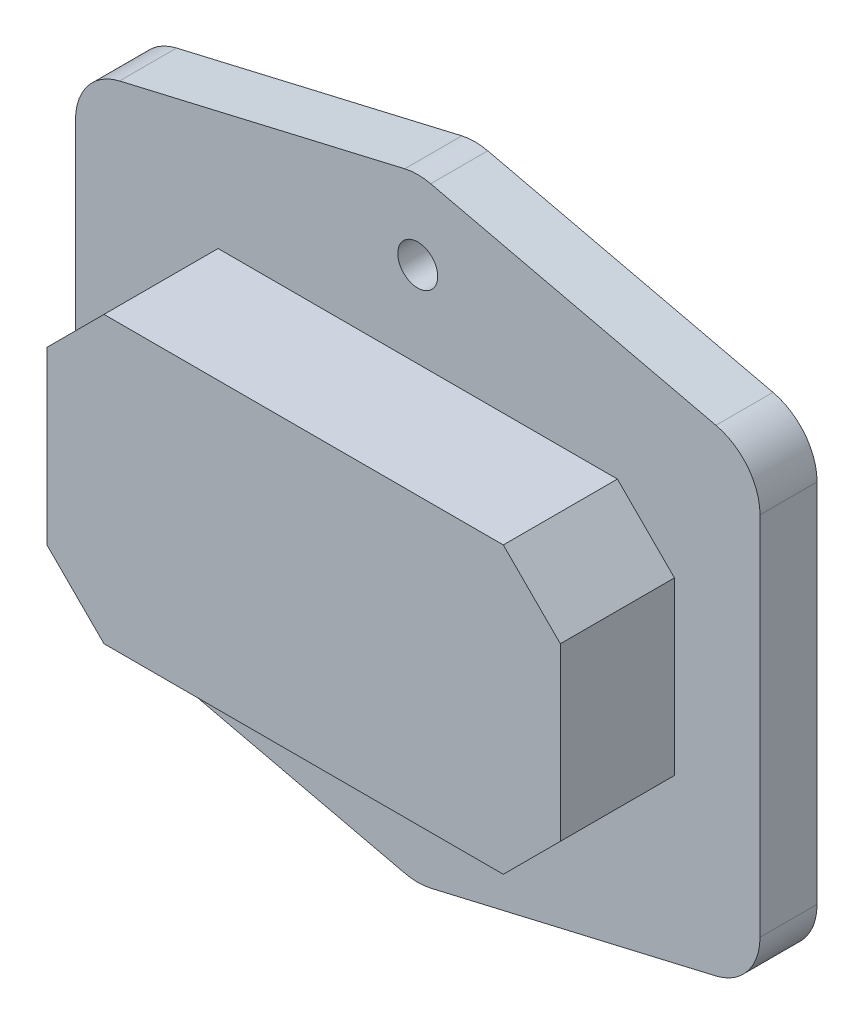
from build123d import *

# Parameters (mm, degrees)
SKETCH1_W           = 45
SKETCH1_H           = 25
BOSS_EXTRUDE1_DEPTH = 10
SKETCH2_R           = 1.75
BOSS_EXTRUDE2_DEPTH = 5
FILLET1_R           = 5
CUT_EXTRUDE1_DEPTH  = 10
SKETCH4_W           = 1
SKETCH4_H           = 20
BOSS_EXTRUDE3_DEPTH = 15
BOSS_EXTRUDE4_DEPTH = 11
CHAMFER1_SIZE       = 5


with BuildPart() as part:
    # Sketch1 → Boss-Extrude1 (new body)
    with BuildSketch(Plane.XY):
        Rectangle(SKETCH1_W, SKETCH1_H)
    extrude(amount=BOSS_EXTRUDE1_DEPTH)

    # Sketch2 → Boss-Extrude2 (add)
    with BuildSketch(Plane(origin=(0, 0, 0), x_dir=(-1, 0, 0), z_dir=(0, 0, -1))):
        Polygon((-30, 20), (-30, -20), (0, -27), (30, -20), (30, 20), (0, 27), align=None)
        with Locations((0, 20)):
            Circle(SKETCH2_R, mode=Mode.SUBTRACT)
        with Locations((0, -20)):
            Circle(SKETCH2_R, mode=Mode.SUBTRACT)
    extrude(amount=BOSS_EXTRUDE2_DEPTH)

    # Fillet1
    fillet1_edges = [part.edges().sort_by_distance(p)[0] for p in [
        (0, -27, -2.5),
        (-30, -20, -2.5),
        (-30, 20, -2.5),
        (0, 27, -2.5),
        (30, 20, -2.5),
        (30, -20, -2.5),
    ]]
    fillet(fillet1_edges, radius=FILLET1_R)

    # Sketch3 → Cut-Extrude1 (cut)
    with BuildSketch(Plane(origin=(0, 0, -5), x_dir=(-1, 0, 0), z_dir=(0, 0, -1))):
        Polygon((5, 10), (5, -10), (15, -10), (20, -5), (20, 5), (15, 10), align=None)
    extrude(amount=-CUT_EXTRUDE1_DEPTH, mode=Mode.SUBTRACT)

    # Sketch4 → Boss-Extrude3 (add)
    with BuildSketch(Plane(origin=(5, 0, 0), x_dir=(0, 0, -1), z_dir=(1, 0, 0))):
        with Locations((5.5, 0)):
            Rectangle(SKETCH4_W, SKETCH4_H)
    extrude(amount=BOSS_EXTRUDE3_DEPTH)

    # Sketch5 → Boss-Extrude4 (add)
    with BuildSketch(Plane(origin=(7, 0, 0), x_dir=(0, 0, -1), z_dir=(1, 0, 0))):
        with BuildLine():
            Line((6, 8), (7.5, 8))
            Line((7.5, 8), (7.5, 0))
            Line((7.5, 0), (11.5, -6.92820323))
            ThreePointArc((11.5, -6.92820323), (8.839548107, -7.923623984), (6, -8))
            Line((6, -8), (6, 8))
        make_face()
    extrude(amount=BOSS_EXTRUDE4_DEPTH)

    # Chamfer1
    chamfer1_edges = [part.edges().sort_by_distance(p)[0] for p in [
        (22.5, -12.5, 5),
        (-22.5, -12.5, 5),
        (-22.5, 12.5, 5),
        (22.5, 12.5, 5),
    ]]
    chamfer(chamfer1_edges, length=CHAMFER1_SIZE)


solid = part.part
